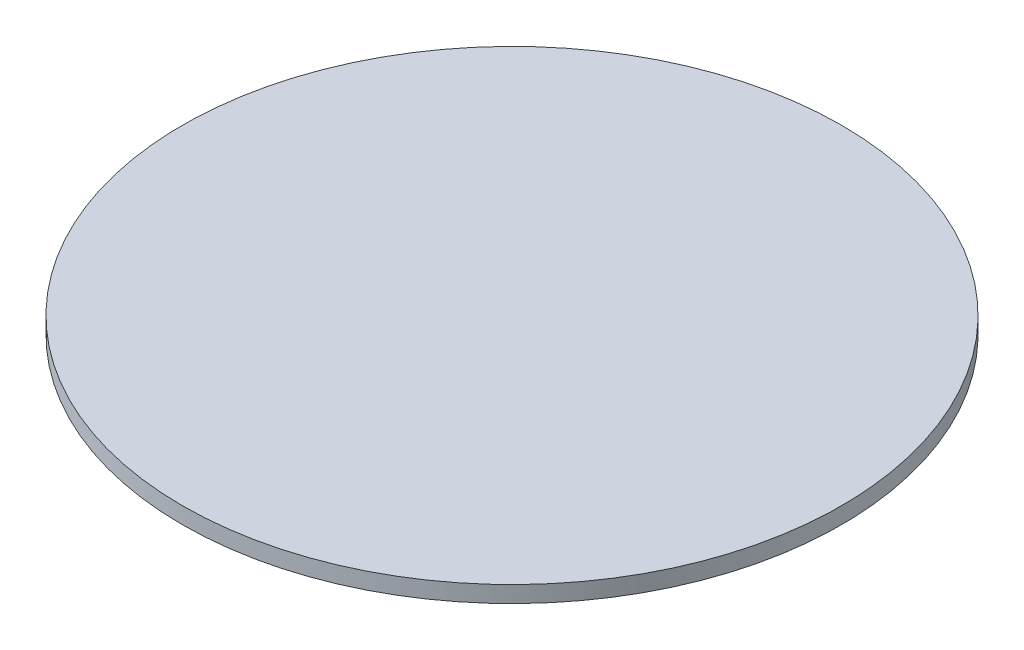
from build123d import *

# Parameters (mm, degrees)
SKETCH_1_R      = 60
EXTRUDE_1_DEPTH = 3


with BuildPart() as part:
    # 草图1 → 凸台-拉伸1 (new body)
    with BuildSketch(Plane(origin=(0, 0, 0), x_dir=(1, 0, 0), z_dir=(0, 1, 0))):
        with Locations(Location((0, 0, 0), (0, 0, 270))):
            Circle(SKETCH_1_R)
    extrude(amount=EXTRUDE_1_DEPTH)


solid = part.part
